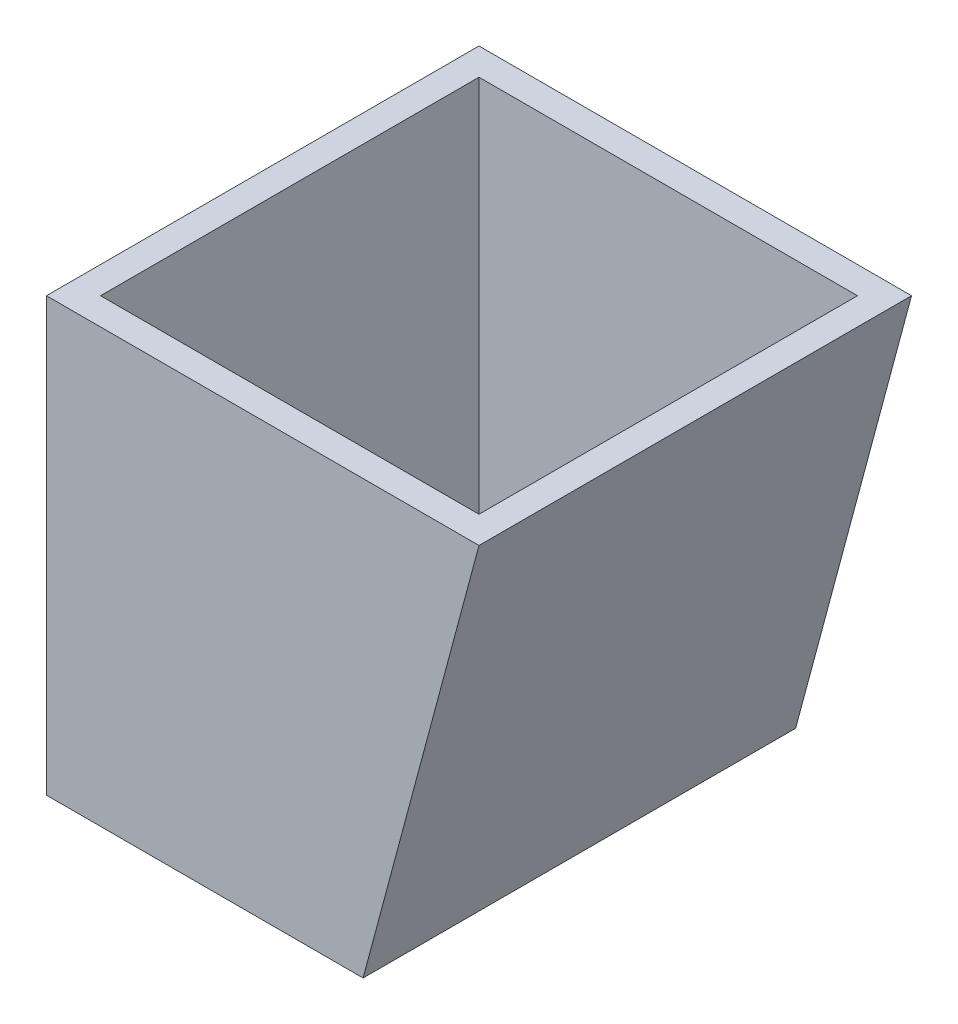
from build123d import *

# Parameters (mm, degrees)
SKETCH10_W          = 50.8
SKETCH10_H          = 50.8
BOSS_EXTRUDE4_DEPTH = 50.8
CUT_EXTRUDE6_DEPTH  = 77.2
SKETCH19_W          = 44.45
SKETCH19_H          = 44.45
CUT_EXTRUDE8_DEPTH  = 47.625
BOSS_EXTRUDE6_DEPTH = 47.625


with BuildPart() as part:
    # Sketch10 → Boss-Extrude4 (new body)
    with BuildSketch(Plane(origin=(0, 0, 0), x_dir=(1, 0, 0), z_dir=(0, 1, 0))):
        Rectangle(SKETCH10_W, SKETCH10_H)
    extrude(amount=BOSS_EXTRUDE4_DEPTH)

    # Sketch17 → Cut-Extrude6 (cut, through all)
    with BuildSketch(Plane.XY.offset(25.4)):
        Polygon((25.4, 0), (25.4, 50.8), (11.788181024, 0), align=None)
    extrude(amount=-CUT_EXTRUDE6_DEPTH, mode=Mode.SUBTRACT)

    # Sketch19 → Cut-Extrude8 (cut)
    with BuildSketch(Plane(origin=(0, 50.8, 0), x_dir=(1, 0, 0), z_dir=(0, 1, 0))):
        Rectangle(SKETCH19_W, SKETCH19_H)
    extrude(amount=-CUT_EXTRUDE8_DEPTH, mode=Mode.SUBTRACT)

    # Sketch20 → Boss-Extrude6 (add)
    with BuildSketch(Plane.XY.offset(25.4)):
        Polygon((22.225, 50.8), (8.613181024, 0), (11.788181024, 0), (25.4, 50.8), align=None)
    extrude(amount=-BOSS_EXTRUDE6_DEPTH)


solid = part.part
